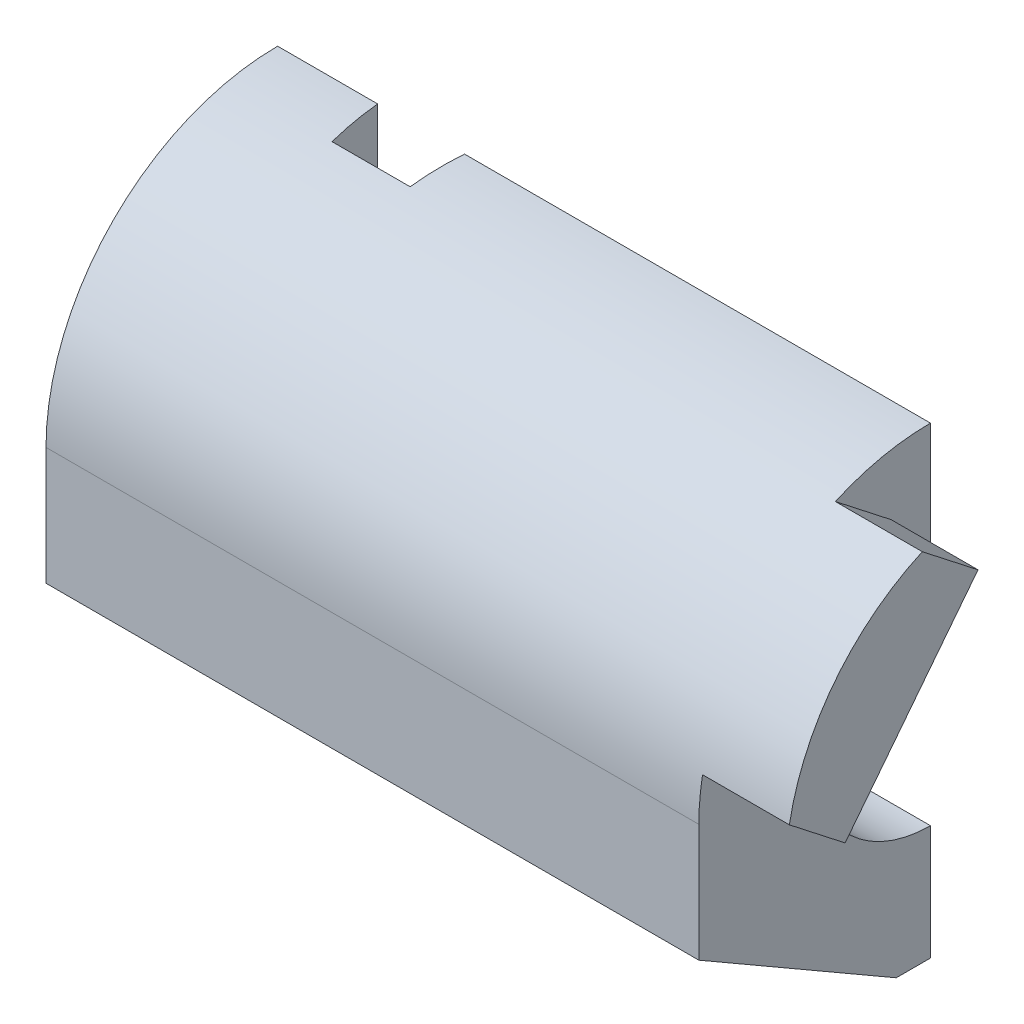
from build123d import *

# Parameters (mm, degrees)
BOSS_EXTRUDE1_DEPTH = 124
SKETCH2_R           = 44.45
CUT_EXTRUDE1_DEPTH  = 78
SKETCH3_R           = 28.575
CUT_EXTRUDE2_DEPTH  = 170
CUT_EXTRUDE3_DEPTH  = 13
CUT_EXTRUDE4_DEPTH  = 176.681530048
BOSS_EXTRUDE2_START = 33
BOSS_EXTRUDE2_DEPTH = 33


with BuildPart() as part:
    # Sketch1 → Boss-Extrude1 (new, symmetric)
    with BuildSketch(Plane(origin=(0, 0, 0), x_dir=(0, 0, -1), z_dir=(1, 0, 0))):
        with BuildLine():
            Line((0, 88), (0, -88))
            Line((0, -88), (-13, -88))
            Line((-13, -88), (-88, -44.698729811))
            Line((-88, -44.698729811), (-88, 0))
            ThreePointArc((-88, 0), (-62.225396744, 62.225396744), (0, 88))
        make_face()
    extrude(amount=BOSS_EXTRUDE1_DEPTH, both=True)

    # Sketch2 → Cut-Extrude1 (cut)
    with BuildSketch(Plane(origin=(124, 0, 0), x_dir=(0, 0, -1), z_dir=(1, 0, 0))):
        Circle(SKETCH2_R)
    extrude(amount=-CUT_EXTRUDE1_DEPTH, mode=Mode.SUBTRACT)

    # Sketch3 → Cut-Extrude2 (cut)
    with BuildSketch(Plane.ZY.offset(124)):
        Circle(SKETCH3_R)
    extrude(amount=-CUT_EXTRUDE2_DEPTH, mode=Mode.SUBTRACT)

    # Sketch4 → Cut-Extrude3 (cut)
    with BuildSketch(Plane(origin=(0, 0, 0), x_dir=(-1, 0, 0), z_dir=(0, 0, -1))):
        with BuildLine():
            Line((124, -73), (11, -73))
            ThreePointArc((11, -73), (0, -62), (11, -51))
            Line((11, -51), (124, -51))
            Line((124, -51), (124, -73))
        make_face()
    extrude(amount=-CUT_EXTRUDE3_DEPTH, mode=Mode.SUBTRACT)

    # Sketch5 → Cut-Extrude4 (cut, through all)
    with BuildSketch(Plane(origin=(0, 0, 0), x_dir=(1, 0, 0), z_dir=(0, 1, 0))):
        Polygon((-53, 0), (-86, 0), (-84.337715393, -19), (-54.662284607, -19), align=None)
    extrude(amount=CUT_EXTRUDE4_DEPTH, mode=Mode.SUBTRACT)

    # Sketch6 → Boss-Extrude2 (add)
    with BuildSketch(Plane(origin=(124, 0, 0), x_dir=(0, 0, -1), z_dir=(1, 0, 0)).offset(BOSS_EXTRUDE2_START)):
        with BuildLine():
            Line((-36.116548227, 80.247086827), (-14.946427946, 63.707176139))
            Line((-14.946427946, 63.707176139), (-65.430668922, -0.909705656))
            Line((-65.430668922, -0.909705656), (-86.600789204, 15.630205031))
            ThreePointArc((-86.600789204, 15.630205031), (-69.344946317, 54.178209829), (-36.116548227, 80.247086827))
        make_face()
    extrude(amount=-BOSS_EXTRUDE2_DEPTH)


solid = part.part
